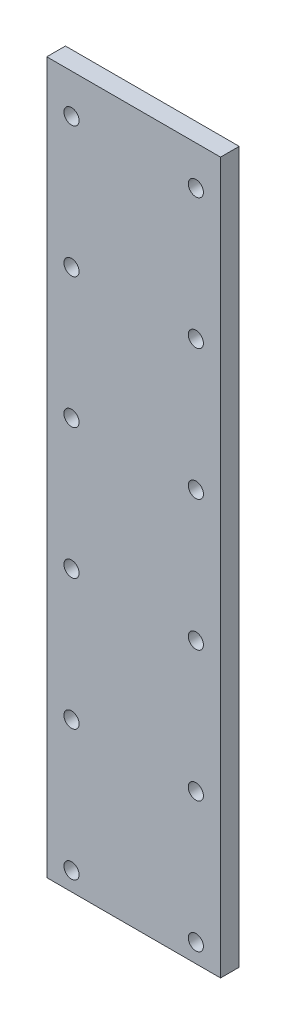
from build123d import *

# Parameters (mm, degrees)
SKETCH1_W           = 27.94
SKETCH1_H           = 114.3
BOSS_EXTRUDE1_DEPTH = 3
SKETCH2_R           = 1.2192
CUT_EXTRUDE1_DEPTH  = 59.90911135
LPATTERN1_COUNT     = 6
LPATTERN1_PITCH     = 21


with BuildPart() as part:
    # Sketch1 → Boss-Extrude1 (new body)
    with BuildSketch(Plane.XY):
        Rectangle(SKETCH1_W, SKETCH1_H)
    extrude(amount=BOSS_EXTRUDE1_DEPTH)

    # Sketch2 → Cut-Extrude1 (cut, through all)
    with BuildSketch(Plane.XY.offset(3)):
        with Locations((-9.9949, -54.15)):
            Circle(SKETCH2_R)
        with Locations((9.9949, -54.15)):
            Circle(SKETCH2_R)
    cut_extrude1 = extrude(amount=-CUT_EXTRUDE1_DEPTH, mode=Mode.SUBTRACT)

    # LPattern1: Cut-Extrude1 ×6
    with Locations(*[(0, i * LPATTERN1_PITCH, 0) for i in range(1, LPATTERN1_COUNT)]):
        add(cut_extrude1, mode=Mode.SUBTRACT)


solid = part.part
